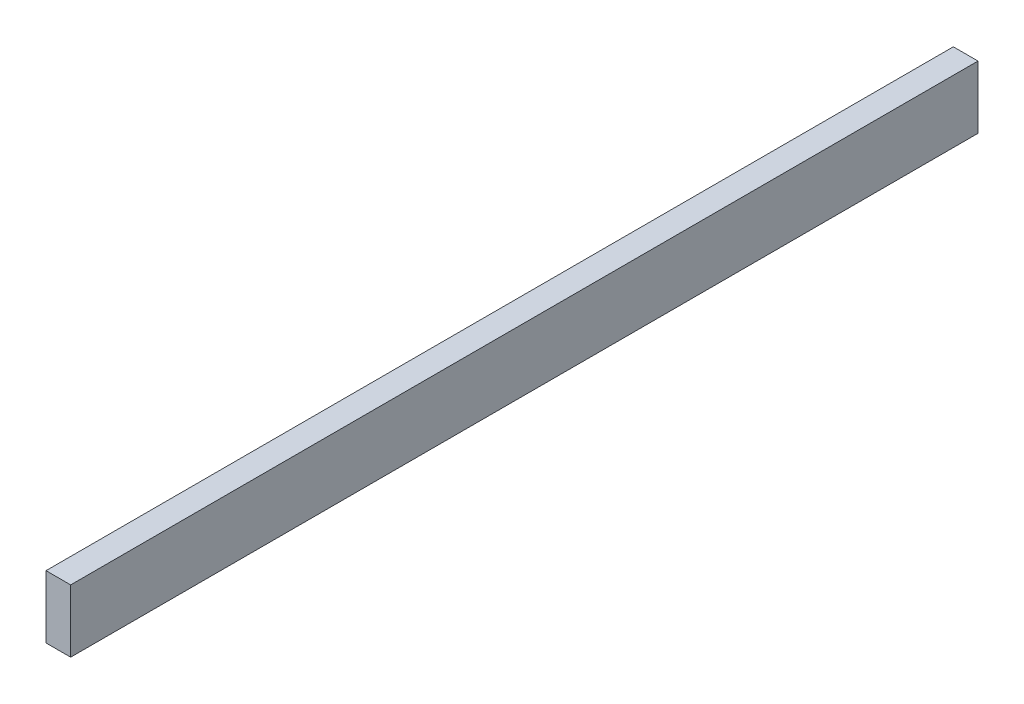
from build123d import *

# Parameters (mm, degrees)
SKETCH1_W           = 184
SKETCH1_H           = 12.7
BOSS_EXTRUDE1_DEPTH = 5


with BuildPart() as part:
    # Sketch1 → Boss-Extrude1 (new body)
    with BuildSketch(Plane(origin=(0, 0, 0), x_dir=(0, 0, -1), z_dir=(1, 0, 0))):
        Rectangle(SKETCH1_W, SKETCH1_H)
    extrude(amount=BOSS_EXTRUDE1_DEPTH)


solid = part.part
